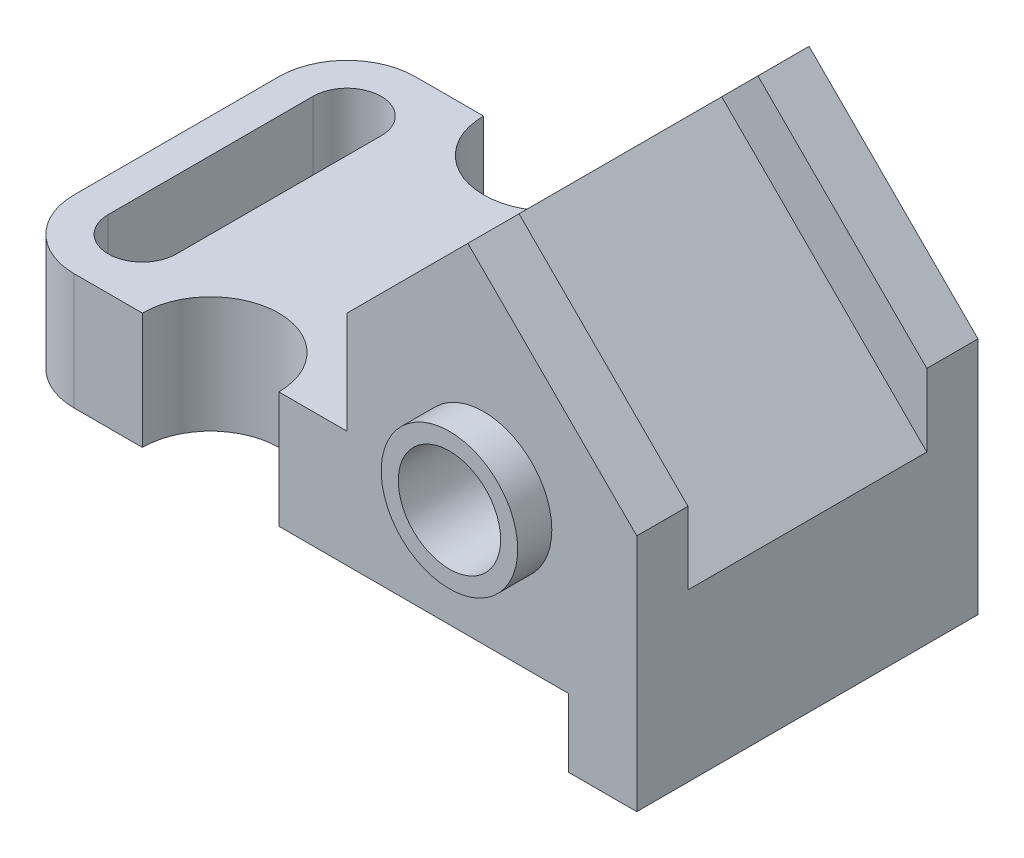
from build123d import *

# Parameters (mm, degrees)
SKETCH_1_W               = 100
SKETCH_1_H               = 34.1
SKETCH_1_W_2             = 20
SKETCH_1_H_2             = 20
EXTRUDE_1_DEPTH          = 100
CUT_EXTRUDE_1_DEPTH      = 228.303332576
CUT_EXTRUDE_1_DEPTH_BACK = 228.303332576
SKETCH_2_W               = 70
SKETCH_2_H               = 15
CUT_EXTRUDE_2_DEPTH      = 221.148063812
CUT_EXTRUDE_2_DEPTH_BACK = 221.148063812
SKETCH_3_R               = 20
CUT_EXTRUDE_3_DEPTH      = 221.148063812
CUT_EXTRUDE_3_DEPTH_BACK = 221.148063812
SKETCH_4_R               = 10
FILLET_3_R               = 20
SKETCH_5_R               = 20
EXTRUDE_2_DEPTH          = 10
CUT_EXTRUDE_4_DEPTH      = 238.040629429
CUT_EXTRUDE_4_DEPTH_BACK = 238.040629429
SKETCH_6_R               = 15


with BuildPart() as part:
    # Эскиз1 → Бобышка-Вытянуть1 (new body)
    with BuildSketch(Plane.XY):
        with Locations((50, 17.05)):
            Rectangle(SKETCH_1_W, SKETCH_1_H)
        with BuildLine():
            Line((100, 34.1), (100, 0))
            Line((100, 0), (164.9, 0))
            Line((164.9, 0), (184.9, 0))
            Line((184.9, 0), (184.9, 34.1))
            Line((184.9, 34.1), (154.142135624, 34.1))
            ThreePointArc((154.142135624, 34.1), (140, 24.1), (125.857864376, 34.1))
            Line((125.857864376, 34.1), (100, 34.1))
        make_face()
        with BuildLine():
            Line((184.9, 50), (135.4, 99.5))
            Line((135.4, 99.5), (135.4, 53.377254638))
            ThreePointArc((135.4, 53.377254638), (148.831760866, 51.224355653), (155, 39.1))
            ThreePointArc((155, 39.1), (154.783978395, 36.563470319), (154.142135624, 34.1))
            Line((154.142135624, 34.1), (184.9, 34.1))
            Line((184.9, 34.1), (184.9, 50))
        make_face()
        with BuildLine():
            Line((100, 64.1), (100, 34.1))
            Line((100, 34.1), (125.857864376, 34.1))
            ThreePointArc((125.857864376, 34.1), (126.556784294, 45.754318257), (135.4, 53.377254638))
            Line((135.4, 53.377254638), (135.4, 99.5))
            Line((135.4, 99.5), (100, 64.1))
        make_face()
        with Locations((174.9, -10)):
            Rectangle(SKETCH_1_W_2, SKETCH_1_H_2)
    extrude(amount=EXTRUDE_1_DEPTH)

    # Эскиз2 → Вырез-Вытянуть1 (cut, two sides: drawn at the far end of the back side and taken through both)
    with BuildSketch(Plane(origin=(17.95, -17.95, 0), x_dir=(0, 0, 1), z_dir=(-0.7071067811865517, 0.7071067811865434, 0)).offset(-CUT_EXTRUDE_1_DEPTH_BACK)):
        with Locations((50, 158.599382901)):
            Rectangle(SKETCH_2_W, SKETCH_2_H)
    extrude(amount=CUT_EXTRUDE_1_DEPTH + CUT_EXTRUDE_1_DEPTH_BACK, mode=Mode.SUBTRACT)

    # Эскиз3 → Вырез-Вытянуть2 (cut, two sides: drawn at the far end of the back side and taken through both)
    with BuildSketch(Plane(origin=(0, 34.1, 0), x_dir=(1, 0, 0), z_dir=(0, 1, 0)).offset(-CUT_EXTRUDE_2_DEPTH_BACK)):
        with Locations((60, 0)):
            Circle(SKETCH_3_R)
        with Locations((60, -100)):
            Circle(SKETCH_3_R)
    extrude(amount=CUT_EXTRUDE_2_DEPTH + CUT_EXTRUDE_2_DEPTH_BACK, mode=Mode.SUBTRACT)

    # Эскиз4 → Вырез-Вытянуть3 (cut, two sides: drawn at the far end of the back side and taken through both)
    with BuildSketch(Plane(origin=(0, 34.1, 0), x_dir=(1, 0, 0), z_dir=(0, 1, 0)).offset(-CUT_EXTRUDE_3_DEPTH_BACK)):
        with BuildLine():
            Line((30, -80), (30, -20))
            ThreePointArc((30, -20), (20, -30), (10, -20))
            Line((10, -20), (10, -80))
            ThreePointArc((10, -80), (20, -70), (30, -80))
        make_face()
        with Locations((20, -20)):
            Circle(SKETCH_4_R)
        with Locations((20, -80)):
            Circle(SKETCH_4_R)
    extrude(amount=CUT_EXTRUDE_3_DEPTH + CUT_EXTRUDE_3_DEPTH_BACK, mode=Mode.SUBTRACT)

    # Скругление3
    fillet_3_edges = [part.edges().sort_by_distance(p)[0] for p in [
        (0, 17.05, 0),
        (0, 17.05, 100),
    ]]
    fillet(fillet_3_edges, radius=FILLET_3_R)

    # Эскиз5 → Бобышка-Вытянуть2 (add)
    with BuildSketch(Plane.XY.offset(100)):
        with Locations((140, 39.1)):
            Circle(SKETCH_5_R)
    extrude(amount=EXTRUDE_2_DEPTH)

    # Эскиз6 → Вырез-Вытянуть4 (cut, two sides: drawn at the far end of the back side and taken through both)
    with BuildSketch(Plane.XY.offset(110).offset(-CUT_EXTRUDE_4_DEPTH_BACK)):
        with Locations((140, 39.1)):
            Circle(SKETCH_6_R)
    extrude(amount=CUT_EXTRUDE_4_DEPTH + CUT_EXTRUDE_4_DEPTH_BACK, mode=Mode.SUBTRACT)


solid = part.part
